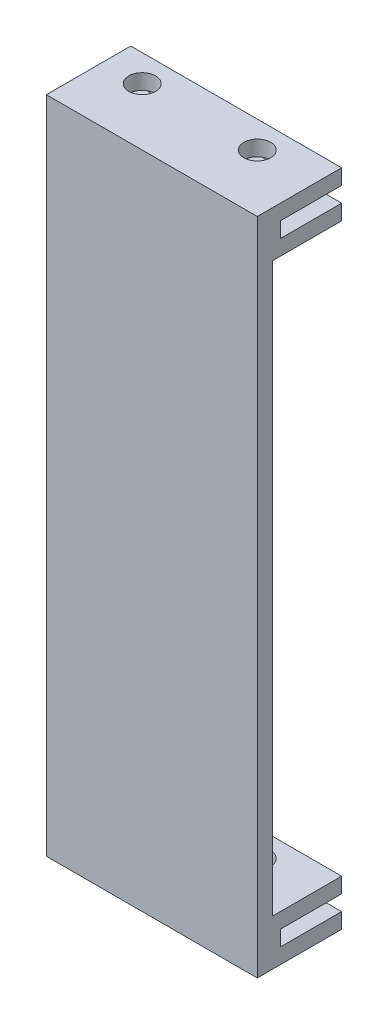
from build123d import *

# Parameters (mm, degrees)
SKETCH_1_W          = 30
SKETCH_1_H          = 11
EXTRUDE_1_DEPTH     = 6
SKETCH_2_W          = 16
SKETCH_2_H          = 2
CUT_EXTRUDE_1_DEPTH = 144
EXTRUDE_2_DEPTH     = 74
SKETCH_4_R          = 1.75
CUT_EXTRUDE_2_DEPTH = 144
SKETCH_5_W          = 11
SKETCH_5_H          = 80
CUT_EXTRUDE_3_DEPTH = 2.5


with BuildPart() as part:
    # 草图1 → 凸台-拉伸1 (new body)
    with BuildSketch(Plane(origin=(0, 0, 0), x_dir=(1, 0, 0), z_dir=(0, 1, 0))):
        Rectangle(SKETCH_1_W, SKETCH_1_H)
    extrude_1 = extrude(amount=EXTRUDE_1_DEPTH)

    # 草图2 → 切除-拉伸1 (cut)
    with BuildSketch(Plane.ZY.offset(15)):
        with Locations((-5.5, 3)):
            Rectangle(SKETCH_2_W, SKETCH_2_H)
    cut_extrude_1 = extrude(amount=-CUT_EXTRUDE_1_DEPTH, mode=Mode.SUBTRACT)

    # 草图3 → 凸台-拉伸2 (add)
    with BuildSketch(Plane(origin=(0, 6, 0), x_dir=(1, 0, 0), z_dir=(0, 1, 0))):
        Polygon((2, 5.5), (-2, 5.5), (-2, -3.5), (-15, -3.5), (-15, -5.5), (15, -5.5), (15, -3.5), (2, -3.5), align=None)
    extrude(amount=EXTRUDE_2_DEPTH)

    # 草图4 → 切除-拉伸2 (cut)
    with BuildSketch(Plane(origin=(0, 6, 0), x_dir=(1, 0, 0), z_dir=(0, 1, 0))):
        with Locations(Location((-7.5, 2, 0), (0, 0, 270))):
            Circle(SKETCH_4_R)
        with Locations(Location((7.5, 2, 0), (0, 0, 270))):
            Circle(SKETCH_4_R)
    cut_extrude_2 = extrude(amount=-CUT_EXTRUDE_2_DEPTH, mode=Mode.SUBTRACT)

    # 草图5 → 切除-拉伸3 (cut)
    with BuildSketch(Plane.ZY.offset(15)):
        with Locations((0, 40)):
            Rectangle(SKETCH_5_W, SKETCH_5_H)
    cut_extrude_3 = extrude(amount=-CUT_EXTRUDE_3_DEPTH, mode=Mode.SUBTRACT)

    # 镜向1: 凸台-拉伸1, 切除-拉伸1, 切除-拉伸2, 切除-拉伸3 across plane
    add(extrude_1.mirror(Plane.ZX.offset(43)))
    add(cut_extrude_1.mirror(Plane.ZX.offset(43)), mode=Mode.SUBTRACT)
    add(cut_extrude_2.mirror(Plane.ZX.offset(43)), mode=Mode.SUBTRACT)
    add(cut_extrude_3.mirror(Plane.ZX.offset(43)), mode=Mode.SUBTRACT)


solid = part.part
